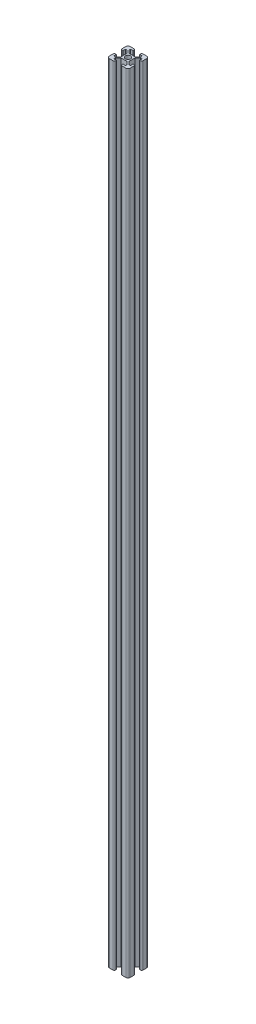
from build123d import *

# Parameters (mm, degrees)
SKETCH_1_W      = 2.42
SKETCH_1_H      = 2
SKETCH_1_W_2    = 2
SKETCH_1_H_2    = 2.42
EXTRUDE_1_DEPTH = 750
FILLET_1_R      = 2
FILLET_2_R      = 1


with BuildPart() as part:
    # 草图1 → 凸台-拉伸1 (new body)
    with BuildSketch(Plane(origin=(0, 0, 0), x_dir=(1, 0, 0), z_dir=(0, 1, 0))):
        with Locations((-4.38, 8.95)):
            Rectangle(SKETCH_1_W, SKETCH_1_H)
        Polygon((-7.101471863, 7.95), (-5.59, 7.95), (-5.59, 9.95), (-7.95, 9.95), (-7.95, 8.798528137), align=None)
        Polygon((-9.101471863, 9.95), (-7.95, 8.798528137), (-7.95, 9.95), align=None)
        Polygon((-9.95, 9.101471863), (-8.798528137, 7.95), (-7.95, 7.95), (-7.95, 8.798528137), (-9.101471863, 9.95), (-9.95, 9.95), align=None)
        Polygon((-9.95, 7.95), (-8.798528137, 7.95), (-9.95, 9.101471863), align=None)
        Polygon((-9.95, 5.59), (-7.95, 5.59), (-7.95, 7.101471863), (-8.798528137, 7.95), (-9.95, 7.95), align=None)
        Polygon((-7.95, 7.95), (-7.101471863, 7.95), (-7.95, 8.798528137), align=None)
        Polygon((-8.798528137, 7.95), (-7.95, 7.101471863), (-7.95, 7.95), align=None)
        with Locations((-8.95, 4.38)):
            Rectangle(SKETCH_1_W_2, SKETCH_1_H_2)
        Polygon((-7.101471863, 7.95), (-5.59, 6.438528137), (-5.59, 7.95), align=None)
        Polygon((-7.95, 7.101471863), (-6.438528137, 5.59), (-5.59, 5.59), (-5.59, 6.438528137), (-7.101471863, 7.95), (-7.95, 7.95), align=None)
        Polygon((-7.95, 5.59), (-6.438528137, 5.59), (-7.95, 7.101471863), align=None)
        Polygon((-6.438528137, 5.59), (-3.8, 2.951471863), (-3.8, 3.8), (-2.951471863, 3.8), (-5.59, 6.438528137), (-5.59, 5.59), align=None)
        with Locations((4.38, 8.95)):
            Rectangle(SKETCH_1_W, SKETCH_1_H)
        Polygon((7.101471863, 7.95), (7.95, 8.798528137), (7.95, 9.95), (5.59, 9.95), (5.59, 7.95), align=None)
        Polygon((7.95, 8.798528137), (9.101471863, 9.95), (7.95, 9.95), align=None)
        Polygon((8.798528137, 7.95), (9.95, 9.101471863), (9.95, 9.95), (9.101471863, 9.95), (7.95, 8.798528137), (7.95, 7.95), align=None)
        Polygon((8.798528137, 7.95), (9.95, 7.95), (9.95, 9.101471863), align=None)
        Polygon((7.95, 5.59), (9.95, 5.59), (9.95, 7.95), (8.798528137, 7.95), (7.95, 7.101471863), align=None)
        Polygon((7.101471863, 7.95), (7.95, 7.95), (7.95, 8.798528137), align=None)
        Polygon((7.95, 7.101471863), (8.798528137, 7.95), (7.95, 7.95), align=None)
        with Locations((8.95, 4.38)):
            Rectangle(SKETCH_1_W_2, SKETCH_1_H_2)
        Polygon((5.59, 5.59), (6.438528137, 5.59), (7.95, 7.101471863), (7.95, 7.95), (7.101471863, 7.95), (5.59, 6.438528137), align=None)
        Polygon((6.438528137, 5.59), (7.95, 5.59), (7.95, 7.101471863), align=None)
        Polygon((5.59, 7.95), (5.59, 6.438528137), (7.101471863, 7.95), align=None)
        Polygon((3.8, 3.8), (3.8, 2.951471863), (6.438528137, 5.59), (5.59, 5.59), (5.59, 6.438528137), (2.951471863, 3.8), align=None)
        with Locations((8.95, -4.38)):
            Rectangle(SKETCH_1_W_2, SKETCH_1_H_2)
        Polygon((8.798528137, -7.95), (9.95, -7.95), (9.95, -5.59), (7.95, -5.59), (7.95, -7.101471863), align=None)
        Polygon((8.798528137, -7.95), (9.95, -9.101471863), (9.95, -7.95), align=None)
        Polygon((9.101471863, -9.95), (9.95, -9.95), (9.95, -9.101471863), (8.798528137, -7.95), (7.95, -7.95), (7.95, -8.798528137), align=None)
        Polygon((7.95, -9.95), (9.101471863, -9.95), (7.95, -8.798528137), align=None)
        Polygon((7.95, -7.95), (8.798528137, -7.95), (7.95, -7.101471863), align=None)
        Polygon((7.101471863, -7.95), (7.95, -8.798528137), (7.95, -7.95), align=None)
        Polygon((5.59, -9.95), (7.95, -9.95), (7.95, -8.798528137), (7.101471863, -7.95), (5.59, -7.95), align=None)
        with Locations((4.38, -8.95)):
            Rectangle(SKETCH_1_W, SKETCH_1_H)
        Polygon((5.59, -7.95), (7.101471863, -7.95), (5.59, -6.438528137), align=None)
        Polygon((5.59, -6.438528137), (7.101471863, -7.95), (7.95, -7.95), (7.95, -7.101471863), (6.438528137, -5.59), (5.59, -5.59), align=None)
        Polygon((6.438528137, -5.59), (7.95, -7.101471863), (7.95, -5.59), align=None)
        with Locations((-8.95, -4.38)):
            Rectangle(SKETCH_1_W_2, SKETCH_1_H_2)
        Polygon((-8.798528137, -7.95), (-7.95, -7.101471863), (-7.95, -5.59), (-9.95, -5.59), (-9.95, -7.95), align=None)
        Polygon((-7.95, -7.101471863), (-6.438528137, -5.59), (-7.95, -5.59), align=None)
        Polygon((-7.101471863, -7.95), (-5.59, -6.438528137), (-5.59, -5.59), (-6.438528137, -5.59), (-7.95, -7.101471863), (-7.95, -7.95), align=None)
        Polygon((-7.101471863, -7.95), (-5.59, -7.95), (-5.59, -6.438528137), align=None)
        Polygon((-7.95, -9.95), (-5.59, -9.95), (-5.59, -7.95), (-7.101471863, -7.95), (-7.95, -8.798528137), align=None)
        with Locations((-4.38, -8.95)):
            Rectangle(SKETCH_1_W, SKETCH_1_H)
        Polygon((-7.95, -7.95), (-7.95, -8.798528137), (-7.101471863, -7.95), align=None)
        Polygon((-8.798528137, -7.95), (-7.95, -7.95), (-7.95, -7.101471863), align=None)
        Polygon((-9.95, -9.95), (-9.101471863, -9.95), (-7.95, -8.798528137), (-7.95, -7.95), (-8.798528137, -7.95), (-9.95, -9.101471863), align=None)
        Polygon((-9.95, -7.95), (-9.95, -9.101471863), (-8.798528137, -7.95), align=None)
        Polygon((-9.101471863, -9.95), (-7.95, -9.95), (-7.95, -8.798528137), align=None)
        Polygon((-5.59, -6.438528137), (-2.951471863, -3.8), (-3.8, -3.8), (-3.8, -2.951471863), (-6.438528137, -5.59), (-5.59, -5.59), align=None)
        Polygon((2.951471863, -3.8), (5.59, -6.438528137), (5.59, -5.59), (6.438528137, -5.59), (3.8, -2.951471863), (3.8, -3.8), align=None)
        with BuildLine():
            Line((2.140364299, -1.291836161), (3.8, -2.951471863))
            Line((3.8, -2.951471863), (3.8, 2.951471863))
            Line((3.8, 2.951471863), (2.140364299, 1.291836161))
            ThreePointArc((2.140364299, 1.291836161), (2.408413456, 0.670480892), (2.5, 0))
            ThreePointArc((2.5, 0), (2.408413456, -0.670480892), (2.140364299, -1.291836161))
        make_face()
        with BuildLine():
            Line((1.291836161, 2.140364299), (2.951471863, 3.8))
            Line((2.951471863, 3.8), (-2.951471863, 3.8))
            Line((-2.951471863, 3.8), (-1.291836161, 2.140364299))
            ThreePointArc((-1.291836161, 2.140364299), (0, 2.5), (1.291836161, 2.140364299))
        make_face()
        with BuildLine():
            Line((-3.8, 2.951471863), (-3.8, -2.951471863))
            Line((-3.8, -2.951471863), (-2.140364299, -1.291836161))
            ThreePointArc((-2.140364299, -1.291836161), (-2.5, 0), (-2.140364299, 1.291836161))
            Line((-2.140364299, 1.291836161), (-3.8, 2.951471863))
        make_face()
        with BuildLine():
            Line((-2.951471863, -3.8), (2.951471863, -3.8))
            Line((2.951471863, -3.8), (1.291836161, -2.140364299))
            ThreePointArc((1.291836161, -2.140364299), (0, -2.5), (-1.291836161, -2.140364299))
            Line((-1.291836161, -2.140364299), (-2.951471863, -3.8))
        make_face()
        with BuildLine():
            Line((-3.8, -3.8), (-2.951471863, -3.8))
            Line((-2.951471863, -3.8), (-1.291836161, -2.140364299))
            ThreePointArc((-1.291836161, -2.140364299), (-1.767766953, -1.767766953), (-2.140364299, -1.291836161))
            Line((-2.140364299, -1.291836161), (-3.8, -2.951471863))
            Line((-3.8, -2.951471863), (-3.8, -3.8))
        make_face()
        with BuildLine():
            Line((1.291836161, -2.140364299), (2.951471863, -3.8))
            Line((2.951471863, -3.8), (3.8, -3.8))
            Line((3.8, -3.8), (3.8, -2.951471863))
            Line((3.8, -2.951471863), (2.140364299, -1.291836161))
            ThreePointArc((2.140364299, -1.291836161), (1.767766953, -1.767766953), (1.291836161, -2.140364299))
        make_face()
        with BuildLine():
            Line((2.140364299, 1.291836161), (3.8, 2.951471863))
            Line((3.8, 2.951471863), (3.8, 3.8))
            Line((3.8, 3.8), (2.951471863, 3.8))
            Line((2.951471863, 3.8), (1.291836161, 2.140364299))
            ThreePointArc((1.291836161, 2.140364299), (1.767766953, 1.767766953), (2.140364299, 1.291836161))
        make_face()
        with BuildLine():
            Line((-3.8, 3.8), (-3.8, 2.951471863))
            Line((-3.8, 2.951471863), (-2.140364299, 1.291836161))
            ThreePointArc((-2.140364299, 1.291836161), (-1.767766953, 1.767766953), (-1.291836161, 2.140364299))
            Line((-1.291836161, 2.140364299), (-2.951471863, 3.8))
            Line((-2.951471863, 3.8), (-3.8, 3.8))
        make_face()
    extrude(amount=EXTRUDE_1_DEPTH)

    # 圆角1
    fillet_1_edges = [part.edges().sort_by_distance(p)[0] for p in [
        (-9.95, 375, 9.95),
        (-9.95, 375, -9.95),
        (9.95, 375, -9.95),
        (9.95, 375, 9.95),
    ]]
    fillet(fillet_1_edges, radius=FILLET_1_R)

    # 圆角2
    fillet_2_edges = [part.edges().sort_by_distance(p)[0] for p in [
        (3.17, 375, 9.95),
        (-3.17, 375, 9.95),
        (-9.95, 375, 3.17),
        (-9.95, 375, -3.17),
        (-3.17, 375, -9.95),
        (3.17, 375, -9.95),
        (9.95, 375, -3.17),
        (9.95, 375, 3.17),
    ]]
    fillet(fillet_2_edges, radius=FILLET_2_R)


solid = part.part
